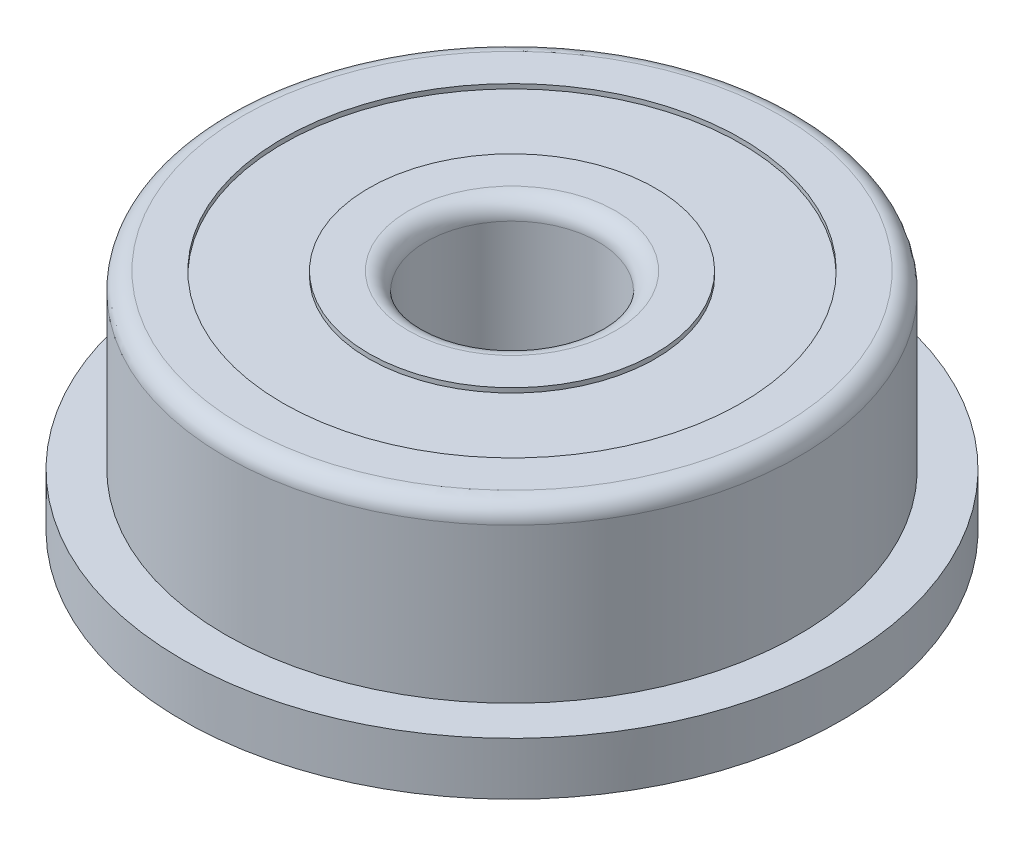
from build123d import *

# Parameters (mm, degrees)
SKETCH1_R           = 5.75
BOSS_EXTRUDE1_DEPTH = 1
SKETCH2_R           = 5
BOSS_EXTRUDE2_DEPTH = 3
SKETCH3_R           = 1.5
CUT_EXTRUDE1_DEPTH  = 10.06228448
SKETCH4_R           = 762
SKETCH4_R_2         = 4
CUT_EXTRUDE2_DEPTH  = 0.08
CUT_EXTRUDE3_START  = -0.08
SKETCH5_R           = 4
SKETCH5_R_2         = 2.5
CUT_EXTRUDE3_DEPTH  = 0.08
FILLET1_R           = 0.31


with BuildPart() as part:
    # Sketch1 → Boss-Extrude1 (new body)
    with BuildSketch(Plane(origin=(0, 0, 0), x_dir=(1, 0, 0), z_dir=(0, 1, 0))):
        with Locations(Location((0, 0, 0), (0, 0, 270))):
            Circle(SKETCH1_R)
    extrude(amount=BOSS_EXTRUDE1_DEPTH)

    # Sketch2 → Boss-Extrude2 (add)
    with BuildSketch(Plane(origin=(0, 1, 0), x_dir=(1, 0, 0), z_dir=(0, 1, 0))):
        with Locations(Location((0, 0, 0), (0, 0, 270))):
            Circle(SKETCH2_R)
    extrude(amount=BOSS_EXTRUDE2_DEPTH)

    # Sketch3 → Cut-Extrude1 (cut, through all)
    with BuildSketch(Plane(origin=(0, 4, 0), x_dir=(1, 0, 0), z_dir=(0, 1, 0))):
        with Locations(Location((0, 0, 0), (0, 0, 270))):
            Circle(SKETCH3_R)
    extrude(amount=-CUT_EXTRUDE1_DEPTH, mode=Mode.SUBTRACT)

    # Sketch4 → Cut-Extrude2 (cut)
    with BuildSketch(Plane.XZ):
        Circle(SKETCH4_R)
        with Locations(Location((0, 0, 0), (0, 0, 270))):
            Circle(SKETCH4_R_2, mode=Mode.SUBTRACT)
    extrude(amount=-CUT_EXTRUDE2_DEPTH, mode=Mode.SUBTRACT)

    # Sketch5 → Cut-Extrude3 (cut)
    with BuildSketch(Plane(origin=(0, 4, 0), x_dir=(1, 0, 0), z_dir=(0, 1, 0)).offset(CUT_EXTRUDE3_START)):
        with Locations(Location((0, 0, 0), (0, 0, 90))):
            Circle(SKETCH5_R)
        with Locations(Location((0, 0, 0), (0, 0, 270))):
            Circle(SKETCH5_R_2, mode=Mode.SUBTRACT)
    extrude(amount=CUT_EXTRUDE3_DEPTH, mode=Mode.SUBTRACT)

    # Fillet1
    fillet1_edges = [part.edges().sort_by_distance(p)[0] for p in [
        (0, 0, -1.5),
        (0, 4, -1.5),
        (0, 4, -5),
    ]]
    fillet(fillet1_edges, radius=FILLET1_R)


solid = part.part
